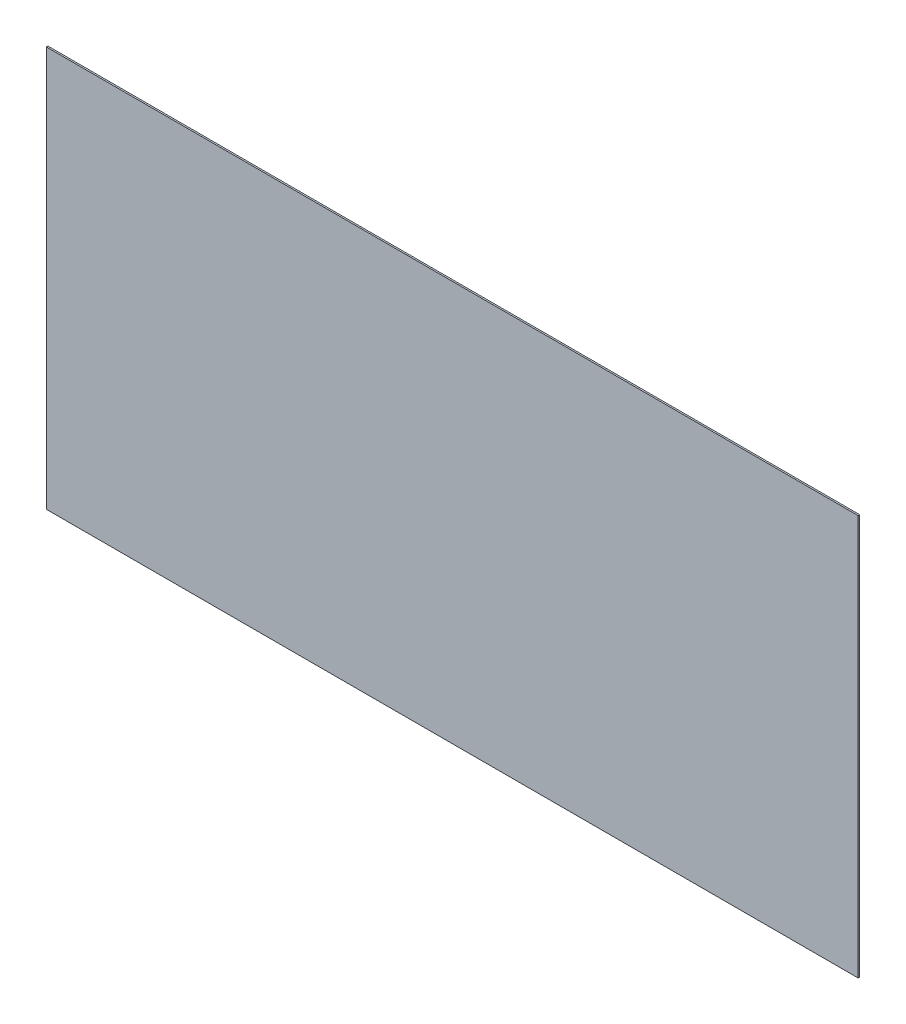
from build123d import *

# Parameters (mm, degrees)
SKETCH1_W           = 259.5
SKETCH1_H           = 128
BOSS_EXTRUDE1_DEPTH = 0.5


with BuildPart() as part:
    # Sketch1 → Boss-Extrude1 (new body)
    with BuildSketch(Plane.XY):
        with Locations((129.75, 64)):
            Rectangle(SKETCH1_W, SKETCH1_H)
    extrude(amount=BOSS_EXTRUDE1_DEPTH)


solid = part.part
